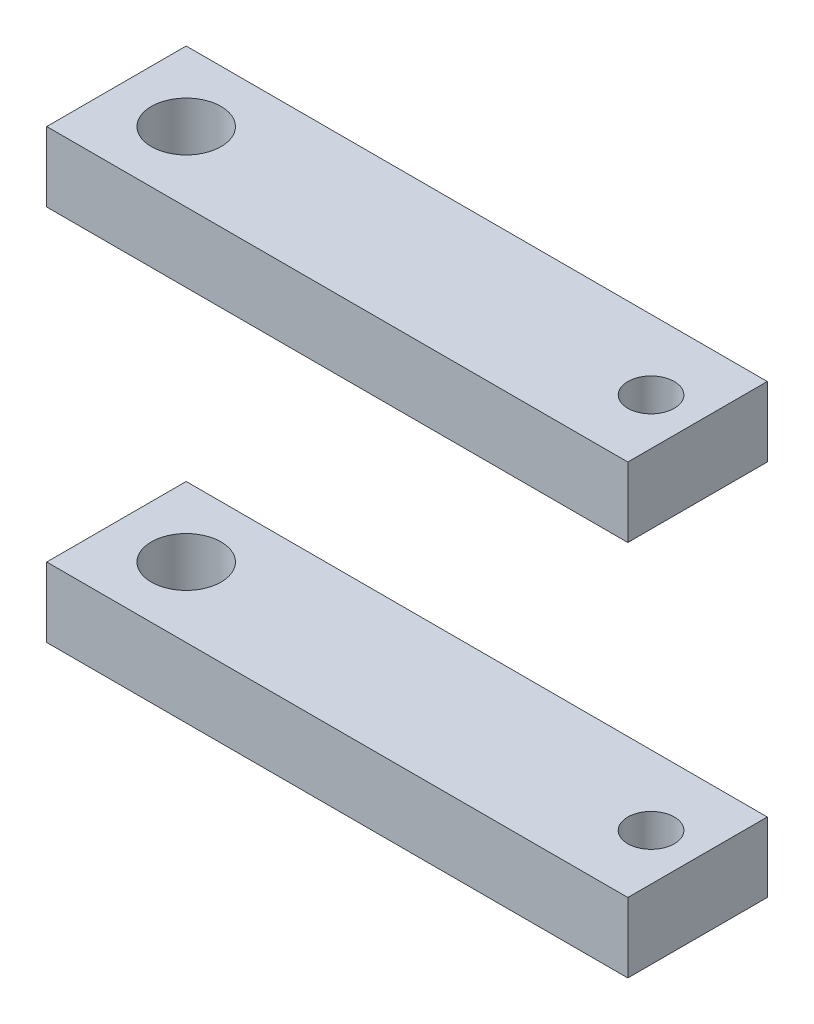
from build123d import *

# Parameters (mm, degrees)
IZIM1_W                       = 50
IZIM1_H                       = 6
Y_KSEKLIK_EKSTR_ZYON1_DEPTH   = 12
Y_KSEKLIK_EKSTR_ZYON1_2_DEPTH = 12
IZIM2_R                       = 3
IZIM2_R_2                     = 2
KES_EKSTR_ZYON1_DEPTH         = 40


with BuildPart() as part:
    # Çizim1 → Yükseklik-Ekstrüzyon1 (new body)
    with BuildSketch(Plane.XY):
        with Locations((-37.52756582, -7.189224138)):
            Rectangle(IZIM1_W, IZIM1_H)
    extrude(amount=Y_KSEKLIK_EKSTR_ZYON1_DEPTH)


with BuildPart() as body_2:
    # Çizim1 → Y_kseklik-Ekstr_zyon1 2 (new body)
    with BuildSketch(Plane.XY):
        with Locations((-37.52756582, -39.639224138)):
            Rectangle(IZIM1_W, IZIM1_H)
    extrude(amount=Y_KSEKLIK_EKSTR_ZYON1_2_DEPTH)


with BuildPart() as kes_ekstr_zyon1_tool:
    # Çizim2 → Kes-Ekstrüzyon1 (new body)
    with BuildSketch(Plane(origin=(0, -4.189224138, 0), x_dir=(1, 0, 0), z_dir=(0, 1, 0))):
        with Locations(Location((-56.52756582, -6, 0), (0, 0, 270))):
            Circle(IZIM2_R)
        with Locations(Location((-16.52756582, -6, 0), (0, 0, 270))):
            Circle(IZIM2_R_2)
    extrude(amount=-KES_EKSTR_ZYON1_DEPTH)


with BuildPart() as part_1:
    add(part.part)

    # Kes-Ekstrüzyon1: cut by kes_ekstr_zyon1_tool
    add(kes_ekstr_zyon1_tool.part, mode=Mode.SUBTRACT)


with BuildPart() as body_2_1:
    add(body_2.part)

    # Kes-Ekstrüzyon1: cut by kes_ekstr_zyon1_tool
    add(kes_ekstr_zyon1_tool.part, mode=Mode.SUBTRACT)


solid = Compound([part_1.part, body_2_1.part])
